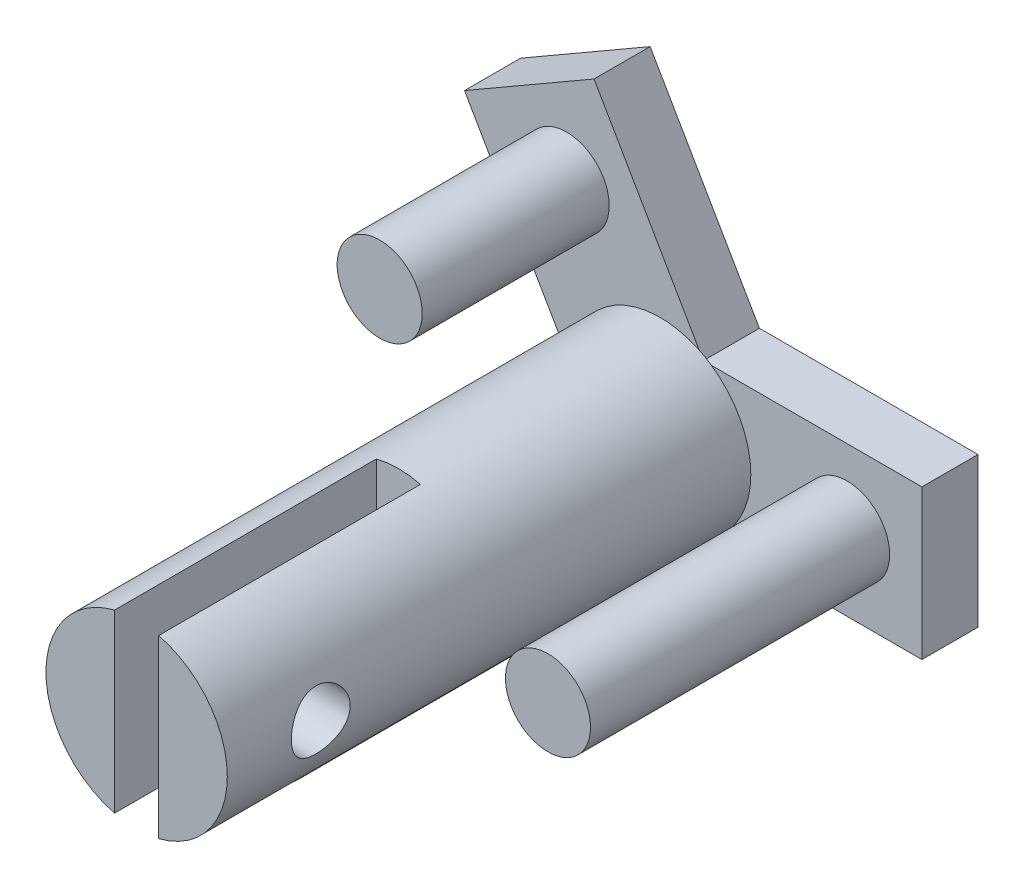
from build123d import *

# Parameters (mm, degrees)
SKETCH1_R               = 4.85
BOSS_EXTRUDE1_DEPTH     = 28
SKETCH2_W               = 2.36
SKETCH2_H               = 10
CUT_EXTRUDE1_DEPTH      = 14
CUT_EXTRUDE2_DEPTH      = 30.049671255
CUT_EXTRUDE2_DEPTH_BACK = 30.049671255
SKETCH3_R               = 1.575
BOSS_EXTRUDE2_DEPTH     = 3
SKETCH6_R               = 2.275
BOSS_EXTRUDE3_DEPTH     = 16
CUT_EXTRUDE3_START      = -6
SKETCH7_R               = 2.275
CUT_EXTRUDE3_DEPTH      = 6


with BuildPart() as part:
    # Sketch1 → Boss-Extrude1 (new body)
    with BuildSketch(Plane.XY):
        Circle(SKETCH1_R)
    extrude(amount=BOSS_EXTRUDE1_DEPTH)

    # Sketch2 → Cut-Extrude1 (cut)
    with BuildSketch(Plane.XY.offset(28)):
        Rectangle(SKETCH2_W, SKETCH2_H)
    extrude(amount=-CUT_EXTRUDE1_DEPTH, mode=Mode.SUBTRACT)

    # Sketch3 → Cut-Extrude2 (cut, two sides: drawn at the far end of the back side and taken through both)
    with BuildSketch(Plane.ZY.offset(-1.18).offset(-CUT_EXTRUDE2_DEPTH_BACK)):
        with Locations((23, 0)):
            Circle(SKETCH3_R)
    extrude(amount=CUT_EXTRUDE2_DEPTH + CUT_EXTRUDE2_DEPTH_BACK, mode=Mode.SUBTRACT)

    # Sketch5 → Boss-Extrude2 (add)
    with BuildSketch(Plane(origin=(0, 0, 0), x_dir=(-1, 0, 0), z_dir=(0, 0, -1))):
        Polygon((-2.309401077, -4), (-14, -4), (-14, 4), (-2.309401077, 4), (3.535898385, 14.124355653), (10.464101615, 10.124355653), (4.618802154, 0), (10.464101615, -10.124355653), (3.535898385, -14.124355653), align=None)
    extrude(amount=BOSS_EXTRUDE2_DEPTH)

    # Sketch6 → Boss-Extrude3 (add)
    with BuildSketch(Plane.XY):
        with Locations((-5, 8.660254038)):
            Circle(SKETCH6_R)
        with Locations((-5, -8.660254038)):
            Circle(SKETCH6_R)
        with Locations((10, 0)):
            Circle(SKETCH6_R)
    extrude(amount=BOSS_EXTRUDE3_DEPTH)

    # Sketch7 → Cut-Extrude3 (cut)
    with BuildSketch(Plane.XY.offset(16).offset(CUT_EXTRUDE3_START)):
        with Locations((-5, 8.660254038)):
            Circle(SKETCH7_R)
    extrude(amount=CUT_EXTRUDE3_DEPTH, mode=Mode.SUBTRACT)


solid = part.part
